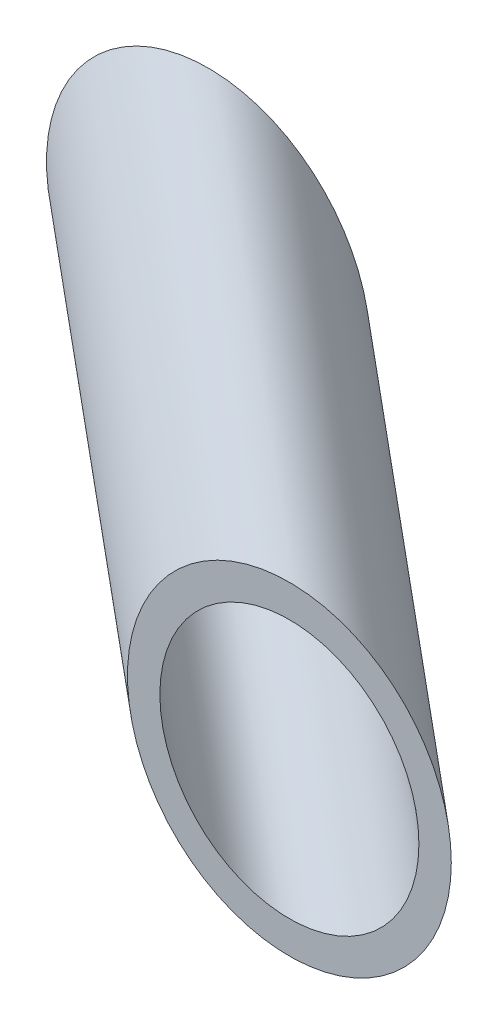
from build123d import *

# Parameters (mm, degrees)
SKETCH1_R   = 12.7
SKETCH1_R_2 = 10.16


with BuildPart() as part:
    # Sweep1: sweep along a path in Sketch2
    with BuildLine(Plane(origin=(0, 0, 0), x_dir=(1, 0, 0), z_dir=(0, 1, 0))) as sweep1_path:
        Line((0, 0), (38.1, -31.75))
    # Sketch1 → Sweep1 (sweep)
    with BuildSketch(Plane.XY):
        Circle(SKETCH1_R)
        Circle(SKETCH1_R_2, mode=Mode.SUBTRACT)
    sweep(path=sweep1_path.line)


solid = part.part
